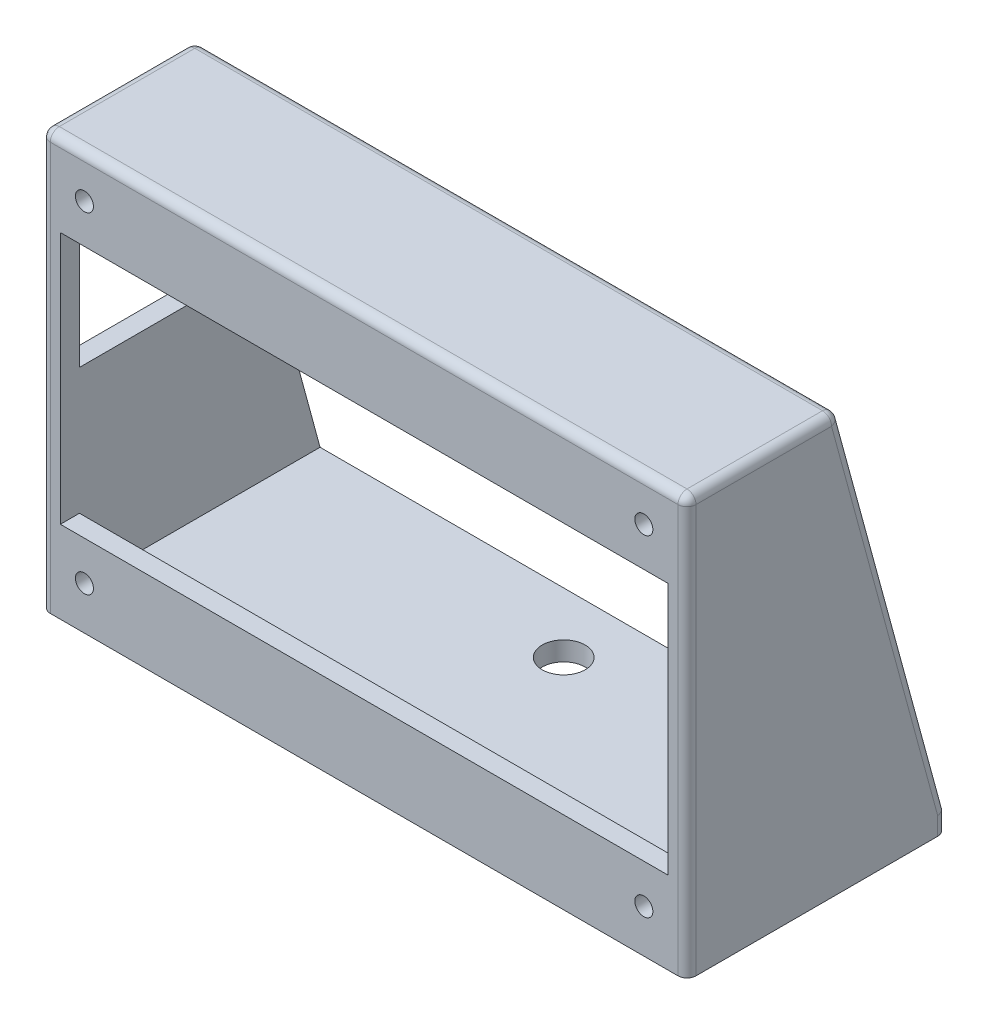
from build123d import *

# Parameters (mm, degrees)
SKETCH1_W               = 107.35
SKETCH1_H               = 69.35
BOSS_EXTRUDE1_DEPTH     = 1.5875
CUT_EXTRUDE2_DEPTH      = 64.920899605
CUT_EXTRUDE2_DEPTH_BACK = 64.920899605
SKETCH2_R               = 1.5
SKETCH2_W               = 101
SKETCH2_H               = 42
SKETCH3_W               = 107.35
SKETCH3_H               = 69.35
SKETCH3_W_2             = 101
SKETCH3_H_2             = 63
BOSS_EXTRUDE2_DEPTH     = 40
SKETCH5_R               = 3.571875
CUT_EXTRUDE3_DEPTH      = 25.4
CUT_EXTRUDE4_DEPTH      = 121.232683914
SKETCH10_W              = 47.370876146
SKETCH10_H              = 31.5
CUT_EXTRUDE5_DEPTH      = 25.4
FILLET1_R               = 1.5


with BuildPart() as part:
    # Sketch1 → Boss-Extrude1 (new, symmetric)
    with BuildSketch(Plane.XY):
        Rectangle(SKETCH1_W, SKETCH1_H)
    extrude(amount=BOSS_EXTRUDE1_DEPTH, both=True)

    # Sketch2 → Cut-Extrude2 (cut, two sides: drawn at the far end of the back side and taken through both)
    with BuildSketch(Plane.XY.offset(-CUT_EXTRUDE2_DEPTH_BACK)):
        with Locations((-46.5, 27.5)):
            Circle(SKETCH2_R)
        with Locations((46.5, 27.5)):
            Circle(SKETCH2_R)
        with Locations((46.5, -27.5)):
            Circle(SKETCH2_R)
        with Locations((-46.5, -27.5)):
            Circle(SKETCH2_R)
        Rectangle(SKETCH2_W, SKETCH2_H)
    extrude(amount=CUT_EXTRUDE2_DEPTH + CUT_EXTRUDE2_DEPTH_BACK, mode=Mode.SUBTRACT)

    # Sketch3 → Boss-Extrude2 (add)
    with BuildSketch(Plane(origin=(0, 0, -1.5875), x_dir=(-1, 0, 0), z_dir=(0, 0, -1))):
        Rectangle(SKETCH3_W, SKETCH3_H)
        Rectangle(SKETCH3_W_2, SKETCH3_H_2, mode=Mode.SUBTRACT)
    extrude(amount=BOSS_EXTRUDE2_DEPTH)

    # Sketch5 → Cut-Extrude3 (cut)
    with BuildSketch(Plane(origin=(0, -31.5, 0), x_dir=(1, 0, 0), z_dir=(0, 1, 0))):
        with Locations(Location((0, 31.5875, 0), (0, 0, 270))):
            Circle(SKETCH5_R)
    extrude(amount=-CUT_EXTRUDE3_DEPTH, mode=Mode.SUBTRACT)

    # Sketch8 → Cut-Extrude4 (cut, through all)
    with BuildSketch(Plane.ZY.offset(53.675)):
        Polygon((-23.5875, 34.675), (-41.5875, -31.5), (-41.5875, 34.675), align=None)
    extrude(amount=-CUT_EXTRUDE4_DEPTH, mode=Mode.SUBTRACT)

    # Sketch10 → Cut-Extrude5 (cut)
    with BuildSketch(Plane(origin=(-50.5, 0, 0), x_dir=(0, 0, -1), z_dir=(1, 0, 0))):
        with Locations((25.272938073, 15.75)):
            Rectangle(SKETCH10_W, SKETCH10_H)
    extrude(amount=-CUT_EXTRUDE5_DEPTH, mode=Mode.SUBTRACT)

    # Fillet1
    fillet1_edges = [part.edges().sort_by_distance(p)[0] for p in [
        (-53.675, 0, 1.5875),
        (-53.675, -33.0875, -41.5875),
        (53.675, 0, 1.5875),
        (53.675, -33.0875, -41.5875),
        (-53.675, 34.675, -11),
        (53.675, 34.675, -11),
        (53.675, 1.5875, -32.5875),
        (0, 34.675, -23.5875),
        (-53.675, -15.75, -37.303404798),
        (0, 34.675, 1.5875),
        (-53.675, 33.0875, -24.019309596),
    ]]
    fillet(fillet1_edges, radius=FILLET1_R)


solid = part.part
